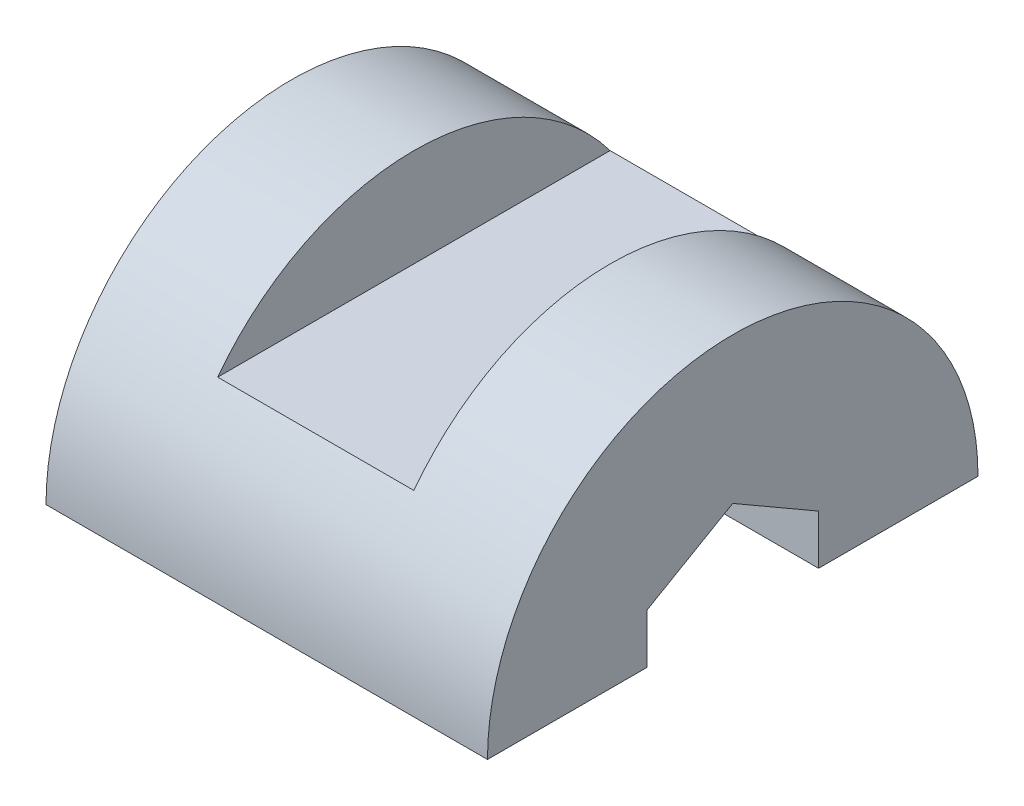
from build123d import *

# Parameters (mm, degrees)
BOSS_EXTRUDE1_DEPTH                 = 90
CUT_EXTRUDE1_REACH                  = 116.455
CUT_EXTRUDE2_REACH                  = 116.455
CUT_EXTRUDE2_END_RADIUS             = 50
SKETCH3_W                           = 40
SKETCH3_H                           = 20
CUT_EXTRUDE2_DIRECTION_2_REACH      = 116.455
CUT_EXTRUDE2_DIRECTION_2_END_RADIUS = 50


with BuildPart() as part:
    # Sketch1 → Boss-Extrude1 (new body)
    with BuildSketch(Plane(origin=(0, 0, 0), x_dir=(0, 0, -1), z_dir=(1, 0, 0))):
        with BuildLine():
            Line((-50, 0), (50, 0))
            ThreePointArc((50, 0), (0, 50), (-50, 0))
        make_face()
    extrude(amount=BOSS_EXTRUDE1_DEPTH)

    # Sketch2 → Cut-Extrude1 (cut, up to next)
    with BuildSketch(Plane.ZY, mode=Mode.PRIVATE) as cut_extrude1_sk1:
        Polygon((0, 20.207259422), (-17.5, 10.103629711), (-17.5, -10.103629711), (0, -20.207259422), (17.5, -10.103629711), (17.5, 10.103629711), align=None)
    cut_extrude1_tool1 = extrude(cut_extrude1_sk1.sketch, amount=-CUT_EXTRUDE1_REACH, mode=Mode.PRIVATE) & part.part
    add(cut_extrude1_tool1.solids().sort_by_distance((0, 0, 0))[0], mode=Mode.SUBTRACT)

    # Cut-Extrude2: up to this cylinder (the profile starts inside it)
    cut_extrude2_end = Plane(origin=(45, 0, 0), z_dir=(-1, 0, 0)) * Cylinder(CUT_EXTRUDE2_END_RADIUS, 333.91, mode=Mode.PRIVATE)
    # Sketch3 → Cut-Extrude2 (cut, up to the surface)
    with BuildSketch(Plane.XY, mode=Mode.PRIVATE) as cut_extrude2_sk1:
        with Locations((45, 40)):
            Rectangle(SKETCH3_W, SKETCH3_H)
    cut_extrude2_tool1 = extrude(cut_extrude2_sk1.sketch, amount=-CUT_EXTRUDE2_REACH, mode=Mode.PRIVATE) & cut_extrude2_end
    add(cut_extrude2_tool1.solids().sort_by_distance((45, 40, 0))[0], mode=Mode.SUBTRACT)

    # Cut-Extrude2 direction 2: up to this cylinder (the profile starts inside it)
    cut_extrude2_direction_2_end = Plane(origin=(45, 0, 0), z_dir=(-1, 0, 0)) * Cylinder(CUT_EXTRUDE2_DIRECTION_2_END_RADIUS, 333.91, mode=Mode.PRIVATE)
    # Sketch3 → Cut-Extrude2 direction 2 (cut, up to the surface)
    with BuildSketch(Plane.XY, mode=Mode.PRIVATE) as cut_extrude2_direction_2_sk1:
        with Locations((45, 40)):
            Rectangle(SKETCH3_W, SKETCH3_H)
    cut_extrude2_direction_2_tool1 = extrude(cut_extrude2_direction_2_sk1.sketch, amount=CUT_EXTRUDE2_DIRECTION_2_REACH, mode=Mode.PRIVATE) & cut_extrude2_direction_2_end
    add(cut_extrude2_direction_2_tool1.solids().sort_by_distance((45, 40, 0))[0], mode=Mode.SUBTRACT)


solid = part.part
